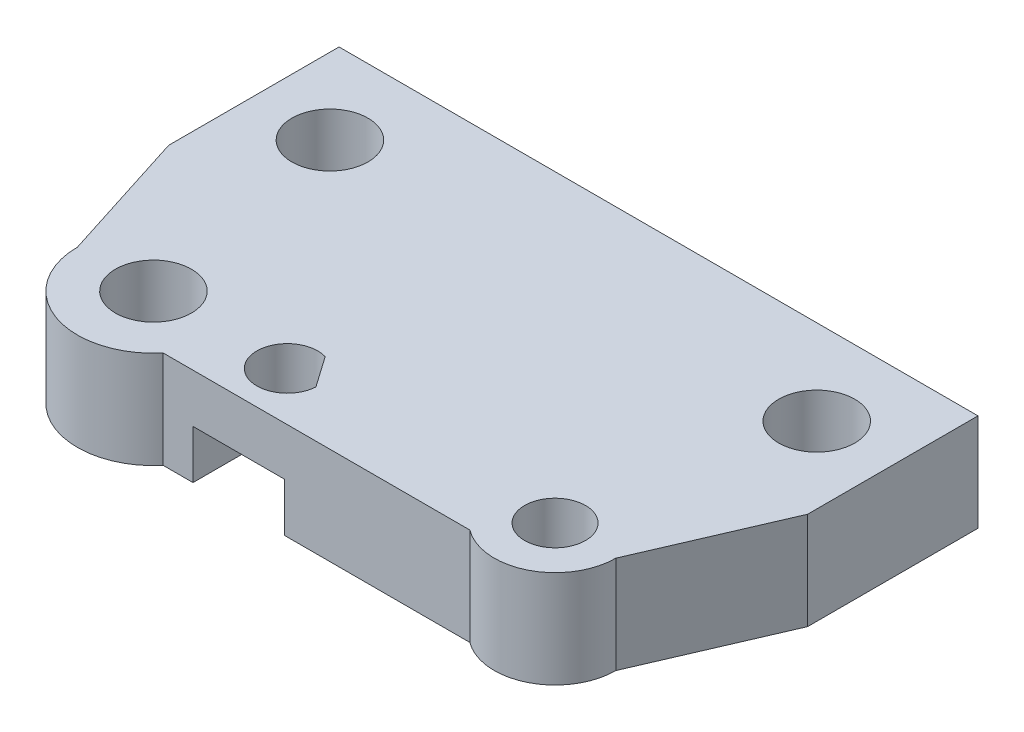
from build123d import *

# Parameters (mm, degrees)
SKETCH1_R           = 3.96875
SKETCH1_R_2         = 3.175
BOSS_EXTRUDE1_DEPTH = 10.16
CUT_EXTRUDE1_DEPTH  = 5.08


with BuildPart() as part:
    # Sketch1 → Boss-Extrude1 (new body)
    with BuildSketch(Plane(origin=(0, 0, 0), x_dir=(1, 0, 0), z_dir=(0, 1, 0))):
        with BuildLine():
            Line((38.1, -5.08), (6.098975836, -5.08))
            ThreePointArc((6.098975836, -5.08), (-2.701229863, -7.463729863), (-7.9375, 0))
            Line((-7.9375, 0), (-12.3825, 13.97))
            Line((-12.3825, 13.97), (-12.3825, 31.75))
            Line((-12.3825, 31.75), (54.2925, 31.75))
            Line((54.2925, 31.75), (54.2925, 13.97))
            Line((54.2925, 13.97), (48.26, 0))
            ThreePointArc((48.26, 0), (44.749806331, -5.679612663), (38.1, -5.08))
        make_face()
        with Locations(Location((0, 0, 0), (0, 0, 270))):
            Circle(SKETCH1_R, mode=Mode.SUBTRACT)
        with Locations(Location((41.91, 0, 0), (0, 0, 270))):
            Circle(SKETCH1_R_2, mode=Mode.SUBTRACT)
        with Locations(Location((46.355, 22.86, 0), (0, 0, 270))):
            Circle(SKETCH1_R, mode=Mode.SUBTRACT)
        with Locations(Location((-4.445, 22.86, 0), (0, 0, 270))):
            Circle(SKETCH1_R, mode=Mode.SUBTRACT)
        with BuildLine():
            Line((17.139504023, -0.186733089), (14.878562514, 3.04222602))
            ThreePointArc((14.878562514, 3.04222602), (11.369192259, -1.821105185), (17.139504023, -0.186733089))
        make_face(mode=Mode.SUBTRACT)
    extrude(amount=-BOSS_EXTRUDE1_DEPTH)

    # Sketch2 → Cut-Extrude1 (cut)
    with BuildSketch(Plane.XZ.offset(10.16)):
        with BuildLine():
            Line((9.2075, 0), (9.2075, 5.08))
            Line((9.2075, 5.08), (18.7325, 5.08))
            Line((18.7325, 5.08), (18.7325, 0))
            ThreePointArc((18.7325, 0), (13.97, -4.7625), (9.2075, 0))
        make_face()
    extrude(amount=-CUT_EXTRUDE1_DEPTH, mode=Mode.SUBTRACT)


solid = part.part
